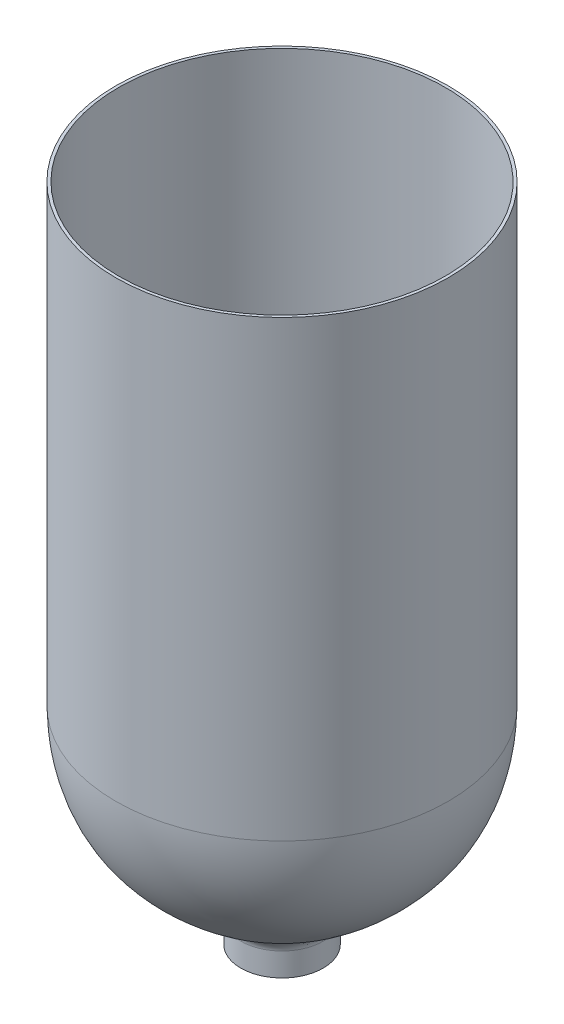
from build123d import *


with BuildPart() as part:
    # Sketch1 → Revolve2 (revolve)
    with BuildSketch(Plane.XY, mode=Mode.PRIVATE) as revolve2_sk:
        with BuildLine():
            Line((-55.88, 118.459427374), (-55.88, -33.940572626))
            add(Edge.make_bspline(
                [(-55.88, -33.940572626), (-54.990575769, -80.080925815), (-14.574030728, -85.897657427), (-13.851510687, -95.680738649)],
                knots=[0, 0, 0, 0, 0.984737572, 0.984737572, 0.984737572, 0.984737572], degree=3))
            Line((-13.851510687, -95.680738649), (-13.851510687, -103.52108655))
            Line((-13.851510687, -103.52108655), (-12.889681114, -103.52108655))
            Line((-12.889681114, -103.52108655), (-12.889681114, -95.680738649))
            add(Edge.make_bspline(
                [(-54.922864743, -33.482666024), (-54.019655344, -80.338147614), (-12.354569903, -85.610371161), (-12.889681114, -95.680738649)],
                knots=[0, 0, 0, 0, 1, 1, 1, 1], degree=3))
            Line((-54.922864743, -33.482666024), (-54.922864743, 118.459427374))
            Line((-54.922864743, 118.459427374), (-55.88, 118.459427374))
        make_face()
    revolve(revolve2_sk.sketch.rotate(Axis((0, 76.879343575, 0), (0, -1, 0)), 270), axis=Axis((0, 76.879343575, 0), (0, -1, 0)))


solid = part.part
